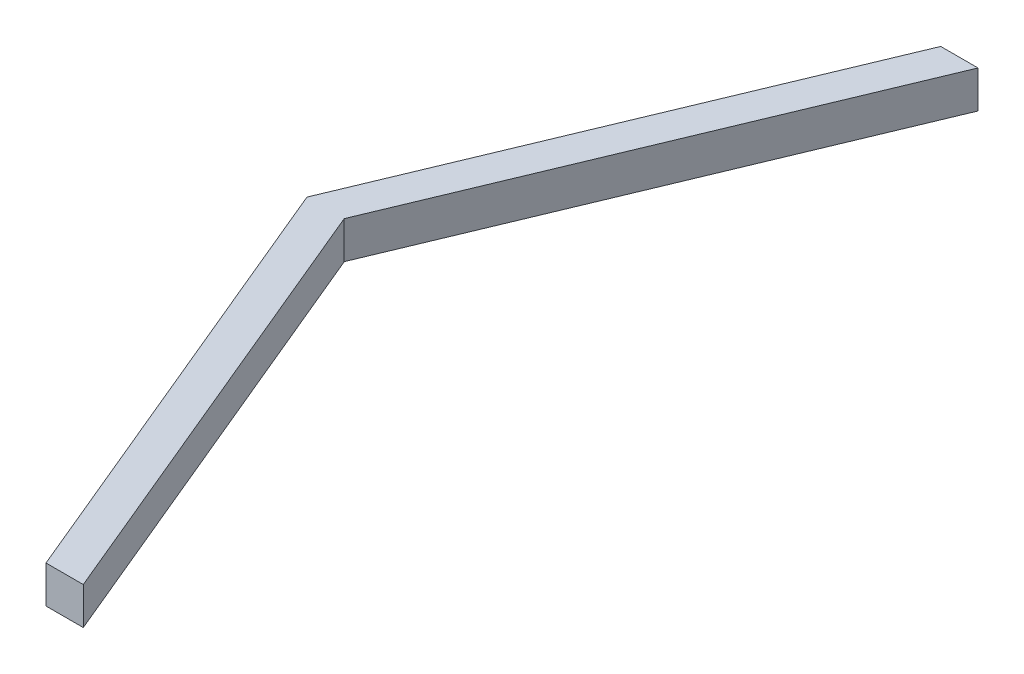
from build123d import *

# Parameters (mm, degrees)
BOSS_EXTRUDE1_DEPTH = 25.4


with BuildPart() as part:
    # Sketch1 → Boss-Extrude1 (new body)
    with BuildSketch(Plane(origin=(0, 0, 0), x_dir=(1, 0, 0), z_dir=(0, 1, 0))):
        Polygon((0, 304.8), (-25.4, 304.8), (-152.4, 0), (-25.4, -304.8), (0, -304.8), (-127, 0), align=None)
    extrude(amount=BOSS_EXTRUDE1_DEPTH)


solid = part.part
